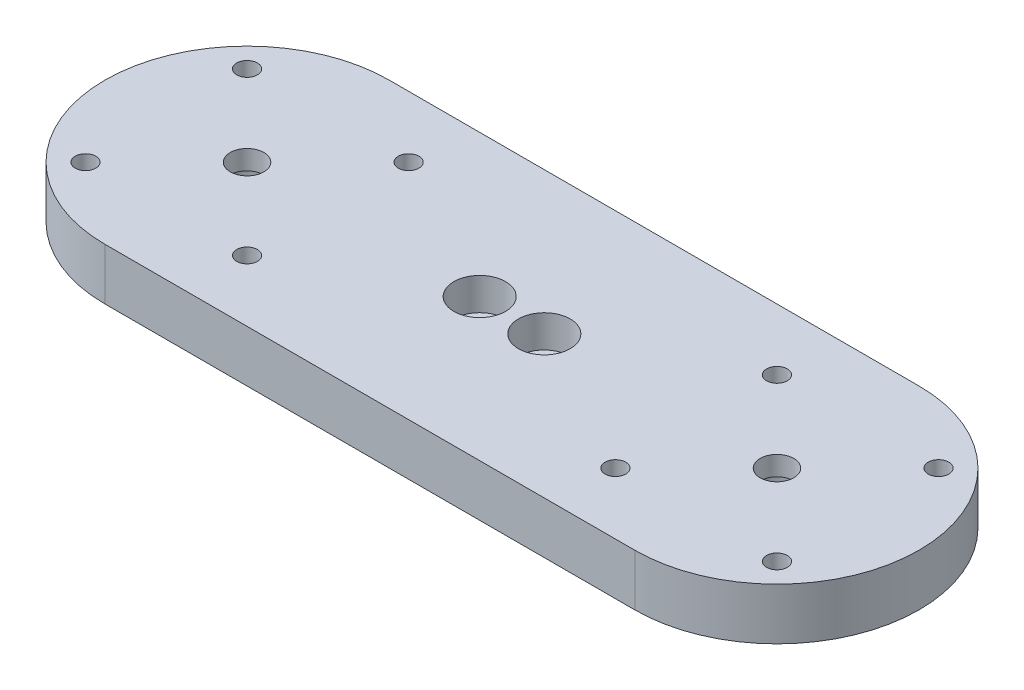
from build123d import *

# Parameters (mm, degrees)
SKETCH_1_R          = 2.6
SKETCH_1_R_2        = 1.6
EXTRUDE_1_DEPTH     = 8
SKETCH_2_R          = 4.5
CUT_EXTRUDE_1_DEPTH = 5
SKETCH_3_R          = 4
CUT_EXTRUDE_2_DEPTH = 5


with BuildPart() as part:
    # 草图1 → 凸台-拉伸1 (new body)
    with BuildSketch(Plane(origin=(0, 0, 0), x_dir=(1, 0, 0), z_dir=(0, 1, 0))):
        with BuildLine():
            Line((0, 22), (82, 22))
            ThreePointArc((82, 22), (104, 0), (82, -22))
            Line((82, -22), (0, -22))
            ThreePointArc((0, -22), (-22, 0), (0, 22))
        make_face()
        with Locations(Location((0, 0, 0), (0, 0, 270))):
            Circle(SKETCH_1_R, mode=Mode.SUBTRACT)
        with Locations(Location((82, 0, 0), (0, 0, 90))):
            Circle(SKETCH_1_R, mode=Mode.SUBTRACT)
        with Locations(Location((12.5, 12.5, 0), (0, 0, 270))):
            Circle(SKETCH_1_R_2, mode=Mode.SUBTRACT)
        with Locations(Location((-12.5, 12.5, 0), (0, 0, 90))):
            Circle(SKETCH_1_R_2, mode=Mode.SUBTRACT)
        with Locations(Location((12.5, -12.5, 0), (0, 0, 90))):
            Circle(SKETCH_1_R_2, mode=Mode.SUBTRACT)
        with Locations(Location((-12.5, -12.5, 0), (0, 0, 270))):
            Circle(SKETCH_1_R_2, mode=Mode.SUBTRACT)
        with Locations(Location((94.5, -12.5, 0), (0, 0, 90))):
            Circle(SKETCH_1_R_2, mode=Mode.SUBTRACT)
        with Locations(Location((69.5, -12.5, 0), (0, 0, 270))):
            Circle(SKETCH_1_R_2, mode=Mode.SUBTRACT)
        with Locations(Location((69.5, 12.5, 0), (0, 0, 90))):
            Circle(SKETCH_1_R_2, mode=Mode.SUBTRACT)
        with Locations(Location((94.5, 12.5, 0), (0, 0, 270))):
            Circle(SKETCH_1_R_2, mode=Mode.SUBTRACT)
        with Locations(Location((36, 0, 0), (0, 0, 270))):
            Circle(SKETCH_1_R_2, mode=Mode.SUBTRACT)
        with Locations(Location((46, 0, 0), (0, 0, 90))):
            Circle(SKETCH_1_R_2, mode=Mode.SUBTRACT)
    extrude(amount=EXTRUDE_1_DEPTH)

    # 草图2 → 切除-拉伸1 (cut)
    with BuildSketch(Plane(origin=(0, 0, 0), x_dir=(-1, 0, 0), z_dir=(0, -1, 0))):
        with Locations(Location((0, 0, 0), (0, 0, 90))):
            Circle(SKETCH_2_R)
        with Locations(Location((-82, 0, 0), (0, 0, 90))):
            Circle(SKETCH_2_R)
    extrude(amount=-CUT_EXTRUDE_1_DEPTH, mode=Mode.SUBTRACT)

    # 草图3 → 切除-拉伸2 (cut)
    with BuildSketch(Plane(origin=(0, 8, 0), x_dir=(1, 0, 0), z_dir=(0, 1, 0))):
        with Locations(Location((36, 0, 0), (0, 0, 270))):
            Circle(SKETCH_3_R)
        with Locations(Location((46, 0, 0), (0, 0, 270))):
            Circle(SKETCH_3_R)
    extrude(amount=-CUT_EXTRUDE_2_DEPTH, mode=Mode.SUBTRACT)


solid = part.part
